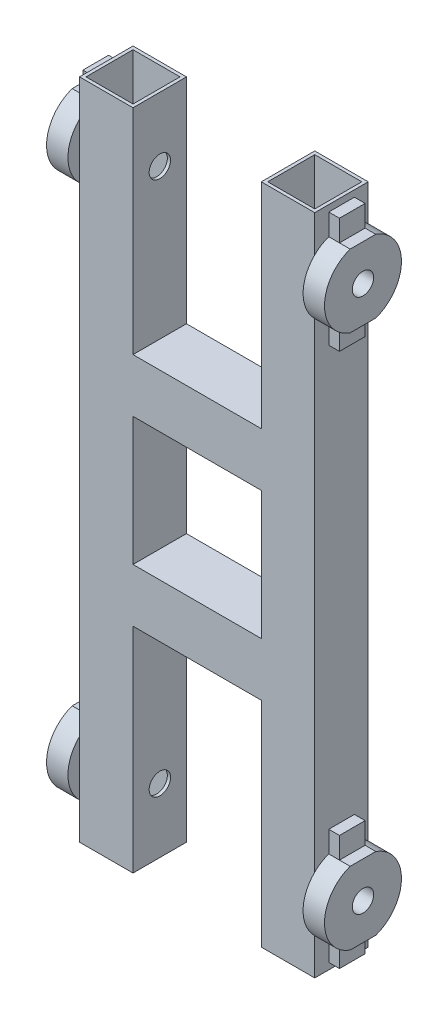
from build123d import *

# Parameters (mm, degrees)
SKETCH1_W           = 25
SKETCH1_H           = 25
SKETCH1_W_2         = 22
SKETCH1_H_2         = 22
BOSS_EXTRUDE1_DEPTH = 310
SKETCH2_W           = 25
SKETCH2_H           = 25
SKETCH2_W_2         = 22
SKETCH2_H_2         = 22
BOSS_EXTRUDE2_DEPTH = 30
SKETCH8_R           = 5
CUT_EXTRUDE1_DEPTH  = 25
SKETCH9_R           = 18
SKETCH9_R_2         = 5
BOSS_EXTRUDE3_DEPTH = 10
SKETCH10_R          = 18
SKETCH10_R_2        = 5
BOSS_EXTRUDE4_DEPTH = 10
SKETCH11_W          = 12
SKETCH11_H          = 10
CUT_EXTRUDE2_DEPTH  = 5


with BuildPart() as part:
    # Sketch1 → Boss-Extrude1 (new body)
    with BuildSketch(Plane(origin=(0, 0, 0), x_dir=(1, 0, 0), z_dir=(0, 1, 0))):
        with Locations((30.5, -0.057992327)):
            Rectangle(SKETCH1_W, SKETCH1_H)
        with Locations((30.5, -0.057992327)):
            Rectangle(SKETCH1_W_2, SKETCH1_H_2, mode=Mode.SUBTRACT)
    boss_extrude1 = extrude(amount=BOSS_EXTRUDE1_DEPTH)

    # Sketch2 → Boss-Extrude2 (add)
    # profile 1 of 2: a face of its own
    with BuildSketch(Plane.ZY.offset(-18)):
        with Locations((0.057992327, 197.5)):
            Rectangle(SKETCH2_W, SKETCH2_H)
        with Locations((0.057992327, 197.5)):
            Rectangle(SKETCH2_W_2, SKETCH2_H_2, mode=Mode.SUBTRACT)
    # profile 2 of 2: a face of its own
    with BuildSketch(Plane.ZY.offset(-18)):
        with Locations((0.057992327, 112.5)):
            Rectangle(SKETCH2_W, SKETCH2_H)
        with Locations((0.057992327, 112.5)):
            Rectangle(SKETCH2_W_2, SKETCH2_H_2, mode=Mode.SUBTRACT)
    boss_extrude2 = extrude(amount=BOSS_EXTRUDE2_DEPTH)

    # Sketch8 → Cut-Extrude1 (cut)
    with BuildSketch(Plane.ZY.offset(-18)):
        with Locations((0, 280)):
            Circle(SKETCH8_R)
        with Locations((0, 30)):
            Circle(SKETCH8_R)
    cut_extrude1 = extrude(amount=-CUT_EXTRUDE1_DEPTH, mode=Mode.SUBTRACT)

    # Sketch9 → Boss-Extrude3 (add)
    # profile 1 of 3: a face of its own
    with BuildSketch(Plane(origin=(43, 0, 0), x_dir=(0, 0, -1), z_dir=(1, 0, 0))):
        with Locations((0, 30)):
            Circle(SKETCH9_R)
        with Locations(Location((0, 30, 0), (0, 0, 180))):
            Circle(SKETCH9_R_2, mode=Mode.SUBTRACT)
    # profile 2 of 3: a face of its own
    with BuildSketch(Plane(origin=(43, 0, 0), x_dir=(0, 0, -1), z_dir=(1, 0, 0))):
        with BuildLine():
            Line((-6, 13.029437252), (-6, 3.029437252))
            Line((-6, 3.029437252), (6, 3.029437252))
            Line((6, 3.029437252), (6, 13.029437252))
            ThreePointArc((6, 13.029437252), (0, 12), (-6, 13.029437252))
        make_face()
    # profile 3 of 3: a face of its own
    with BuildSketch(Plane(origin=(43, 0, 0), x_dir=(0, 0, -1), z_dir=(1, 0, 0))):
        with BuildLine():
            Line((-6, 46.970562748), (-6, 56.970562748))
            Line((-6, 56.970562748), (6, 56.970562748))
            Line((6, 56.970562748), (6, 46.970562748))
            ThreePointArc((6, 46.970562748), (0, 48), (-6, 46.970562748))
        make_face()
    boss_extrude3 = extrude(amount=BOSS_EXTRUDE3_DEPTH)

    # Sketch10 → Boss-Extrude4 (add)
    # profile 1 of 3: a face of its own
    with BuildSketch(Plane(origin=(43, 0, 0), x_dir=(0, 0, -1), z_dir=(1, 0, 0))):
        with Locations((0, 280)):
            Circle(SKETCH10_R)
        with Locations(Location((0, 280, 0), (0, 0, 180))):
            Circle(SKETCH10_R_2, mode=Mode.SUBTRACT)
    # profile 2 of 3: a face of its own
    with BuildSketch(Plane(origin=(43, 0, 0), x_dir=(0, 0, -1), z_dir=(1, 0, 0))):
        with BuildLine():
            Line((-6, 296.970562748), (-6, 306.970562748))
            Line((-6, 306.970562748), (6, 306.970562748))
            Line((6, 306.970562748), (6, 296.970562748))
            ThreePointArc((6, 296.970562748), (0, 298), (-6, 296.970562748))
        make_face()
    # profile 3 of 3: a face of its own
    with BuildSketch(Plane(origin=(43, 0, 0), x_dir=(0, 0, -1), z_dir=(1, 0, 0))):
        with BuildLine():
            Line((-6, 263.029437252), (-6, 253.029437252))
            Line((-6, 253.029437252), (6, 253.029437252))
            Line((6, 253.029437252), (6, 263.029437252))
            ThreePointArc((6, 263.029437252), (0, 262), (-6, 263.029437252))
        make_face()
    boss_extrude4 = extrude(amount=BOSS_EXTRUDE4_DEPTH)

    # Sketch11 → Cut-Extrude2 (cut)
    with BuildSketch(Plane(origin=(53, 0, 0), x_dir=(0, 0, -1), z_dir=(1, 0, 0))):
        with Locations((0, 8.029437252)):
            Rectangle(SKETCH11_W, SKETCH11_H)
        with Locations((0, 51.970562748)):
            Rectangle(SKETCH11_W, SKETCH11_H)
        with Locations((0, 258.029437252)):
            Rectangle(SKETCH11_W, SKETCH11_H)
        with Locations((0, 301.970562748)):
            Rectangle(SKETCH11_W, SKETCH11_H)
    cut_extrude2 = extrude(amount=-CUT_EXTRUDE2_DEPTH, mode=Mode.SUBTRACT)

    # Mirror1: Boss-Extrude1, Boss-Extrude2, Cut-Extrude1, Boss-Extrude3, Boss-Extrude4, Cut-Extrude2 across plane
    add(boss_extrude1.mirror(Plane.ZY.offset(12)))
    add(boss_extrude2.mirror(Plane.ZY.offset(12)))
    add(cut_extrude1.mirror(Plane.ZY.offset(12)), mode=Mode.SUBTRACT)
    add(boss_extrude3.mirror(Plane.ZY.offset(12)))
    add(boss_extrude4.mirror(Plane.ZY.offset(12)))
    add(cut_extrude2.mirror(Plane.ZY.offset(12)), mode=Mode.SUBTRACT)


solid = part.part
